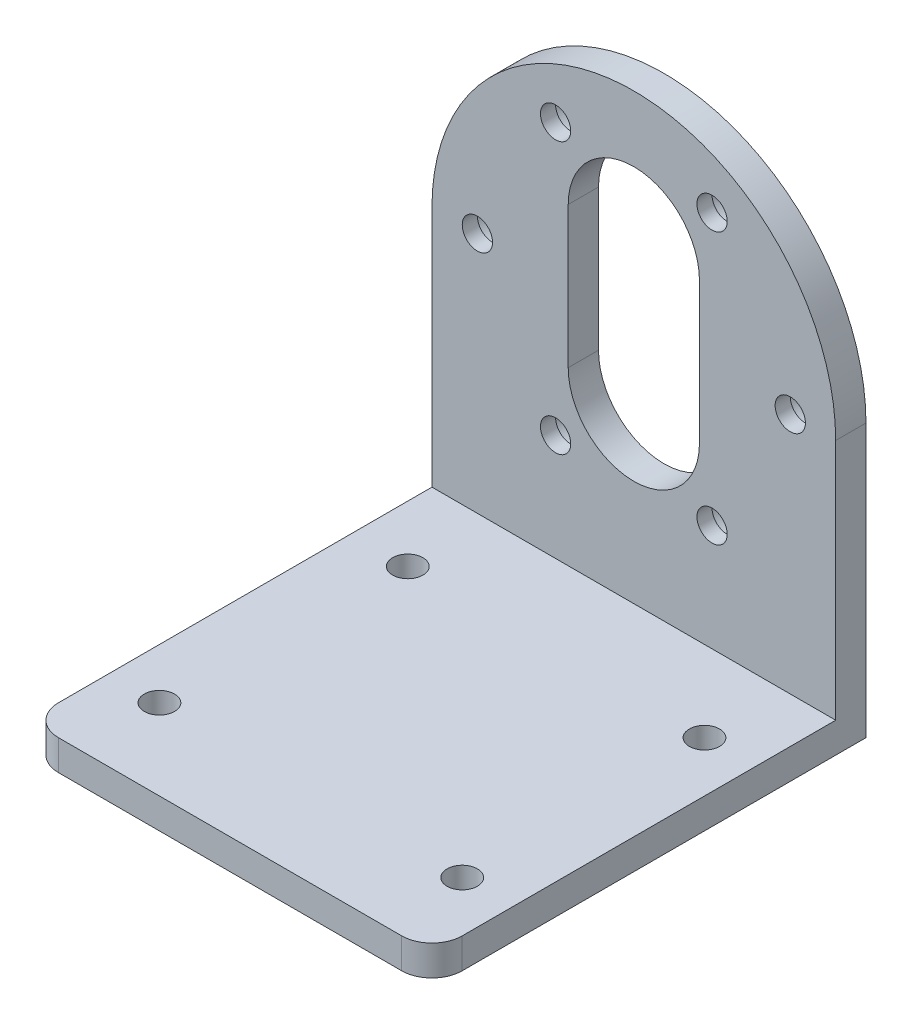
from build123d import *

# Parameters (mm, degrees)
EXTRUDE_1_DEPTH     = 3
SKETCH_2_W          = 40
SKETCH_2_H          = 3
EXTRUDE_2_DEPTH     = 40
SKETCH_3_R          = 2.5
CUT_EXTRUDE_1_DEPTH = 1.5
SKETCH_4_R          = 1.5
CUT_EXTRUDE_2_DEPTH = 66.812232905
SKETCH_5_R          = 1.5
CUT_EXTRUDE_3_DEPTH = 67.76825593
FILLET_1_R          = 3
CUT_EXTRUDE_4_REACH = 68.768


with BuildPart() as part:
    # 草图1 → 凸台-拉伸1 (new body)
    with BuildSketch(Plane.XY):
        with BuildLine():
            Line((-20, 0), (20, 0))
            Line((20, 0), (20, 27))
            ThreePointArc((20, 27), (0, 47), (-20, 27))
            Line((-20, 27), (-20, 0))
        make_face()
    extrude(amount=EXTRUDE_1_DEPTH)

    # 草图2 → 凸台-拉伸2 (add)
    with BuildSketch(Plane.XY.offset(3)):
        with Locations((0, 1.5)):
            Rectangle(SKETCH_2_W, SKETCH_2_H)
    extrude(amount=EXTRUDE_2_DEPTH)

    # 草图3 → 切除-拉伸1 (cut)
    with BuildSketch(Plane(origin=(0, 0, 0), x_dir=(-1, 0, 0), z_dir=(0, 0, -1))):
        with Locations((-15.5, 27)):
            Circle(SKETCH_3_R)
        with Locations((-7.75, 40.423393759)):
            Circle(SKETCH_3_R)
        with Locations((7.75, 40.423393759)):
            Circle(SKETCH_3_R)
        with Locations((15.5, 27)):
            Circle(SKETCH_3_R)
        with Locations((7.75, 13.576606241)):
            Circle(SKETCH_3_R)
        with Locations((-7.75, 13.576606241)):
            Circle(SKETCH_3_R)
    extrude(amount=-CUT_EXTRUDE_1_DEPTH, mode=Mode.SUBTRACT)

    # 草图4 → 切除-拉伸2 (cut, through all)
    with BuildSketch(Plane(origin=(0, 0, 1.5), x_dir=(-1, 0, 0), z_dir=(0, 0, -1))):
        with Locations((-15.5, 27)):
            Circle(SKETCH_4_R)
        with Locations((-7.75, 40.423393759)):
            Circle(SKETCH_4_R)
        with Locations((7.75, 40.423393759)):
            Circle(SKETCH_4_R)
        with Locations((15.5, 27)):
            Circle(SKETCH_4_R)
        with Locations((7.75, 13.576606241)):
            Circle(SKETCH_4_R)
        with Locations((-7.75, 13.576606241)):
            Circle(SKETCH_4_R)
    extrude(amount=-CUT_EXTRUDE_2_DEPTH, mode=Mode.SUBTRACT)

    # 草图5 → 切除-拉伸3 (cut, through all)
    with BuildSketch(Plane.XZ):
        with Locations(Location((-15, 35, 0), (0, 0, 270))):
            Circle(SKETCH_5_R)
        with Locations(Location((15, 35, 0), (0, 0, 270))):
            Circle(SKETCH_5_R)
        with Locations(Location((-14.39414679, 11, 0), (0, 0, 270))):
            Circle(SKETCH_5_R)
        with Locations(Location((15, 11, 0), (0, 0, 270))):
            Circle(SKETCH_5_R)
    extrude(amount=-CUT_EXTRUDE_3_DEPTH, mode=Mode.SUBTRACT)

    # 圆角1
    fillet_1_edges = [part.edges().sort_by_distance(p)[0] for p in [
        (20, 1.5, 43),
        (-20, 1.5, 43),
    ]]
    fillet(fillet_1_edges, radius=FILLET_1_R)

    # 草图6 → 切除-拉伸4 (cut, up to next)
    with BuildSketch(Plane(origin=(0, 0, 0), x_dir=(-1, 0, 0), z_dir=(0, 0, -1)), mode=Mode.PRIVATE) as cut_extrude_4_sk1:
        with BuildLine():
            Line((-6.5, 34), (-6.5, 20))
            ThreePointArc((-6.5, 20), (0, 13.5), (6.5, 20))
            Line((6.5, 20), (6.5, 34))
            ThreePointArc((6.5, 34), (0, 40.5), (-6.5, 34))
        make_face()
    cut_extrude_4_tool1 = extrude(cut_extrude_4_sk1.sketch, amount=-CUT_EXTRUDE_4_REACH, mode=Mode.PRIVATE) & part.part
    add(cut_extrude_4_tool1.solids().sort_by_distance((0, 27, 0))[0], mode=Mode.SUBTRACT)


solid = part.part
